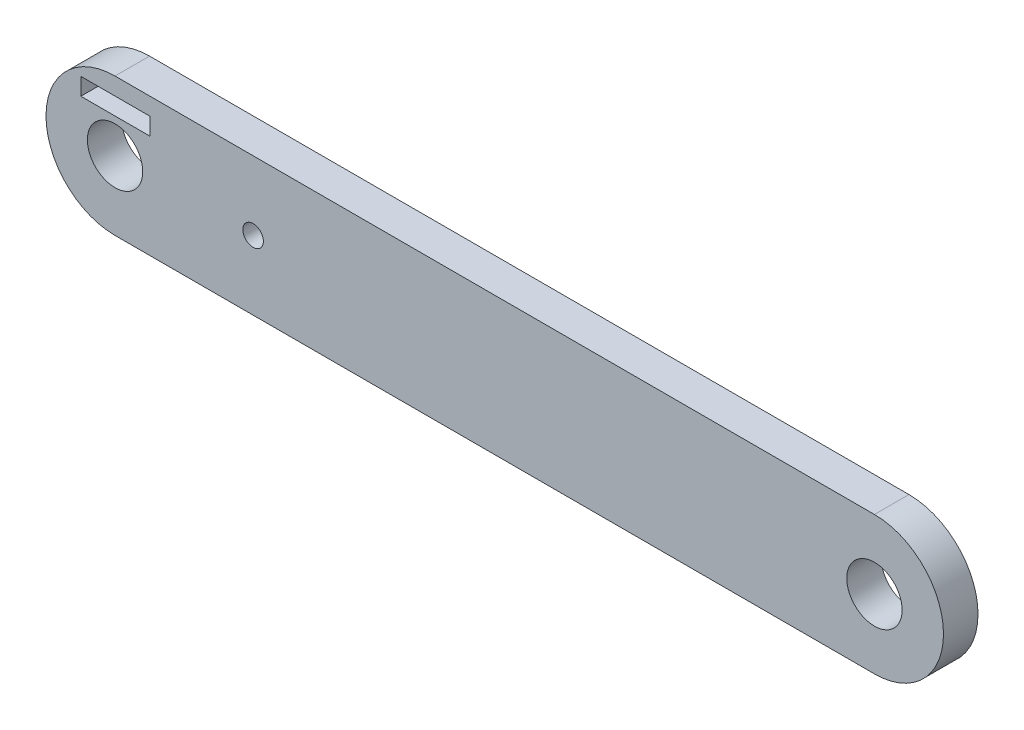
from build123d import *

# Parameters (mm, degrees)
SKETCH1_R           = 4.01
BOSS_EXTRUDE1_DEPTH = 5
CUT_EXTRUDE1_REACH  = 122.52
SKETCH2_R           = 1.49
SKETCH4_W           = 10
SKETCH4_H           = 2.5
CUT_EXTRUDE2_DEPTH  = 10


with BuildPart() as part:
    # Sketch1 → Boss-Extrude1 (new body)
    with BuildSketch(Plane.XY):
        with BuildLine():
            Line((110, 10), (0, 10))
            ThreePointArc((0, 10), (-10, 0), (0, -10))
            Line((0, -10), (110, -10))
            ThreePointArc((110, -10), (120, 0), (110, 10))
        make_face()
        Circle(SKETCH1_R, mode=Mode.SUBTRACT)
        with Locations((110, 0)):
            Circle(SKETCH1_R, mode=Mode.SUBTRACT)
    extrude(amount=BOSS_EXTRUDE1_DEPTH)

    # Sketch2 → Cut-Extrude1 (cut, up to next)
    with BuildSketch(Plane(origin=(0, 0, 0), x_dir=(-1, 0, 0), z_dir=(0, 0, -1)), mode=Mode.PRIVATE) as cut_extrude1_sk1:
        with Locations((-20, 0)):
            Circle(SKETCH2_R)
    cut_extrude1_tool1 = extrude(cut_extrude1_sk1.sketch, amount=-CUT_EXTRUDE1_REACH, mode=Mode.PRIVATE) & part.part
    add(cut_extrude1_tool1.solids().sort_by_distance((20, 0, 0))[0], mode=Mode.SUBTRACT)

    # Sketch4 → Cut-Extrude2 (cut)
    with BuildSketch(Plane(origin=(0, 0, 0), x_dir=(-1, 0, 0), z_dir=(0, 0, -1))):
        with Locations((-0.046889456, 6.235161972)):
            Rectangle(SKETCH4_W, SKETCH4_H)
    extrude(amount=-CUT_EXTRUDE2_DEPTH, mode=Mode.SUBTRACT)


solid = part.part
